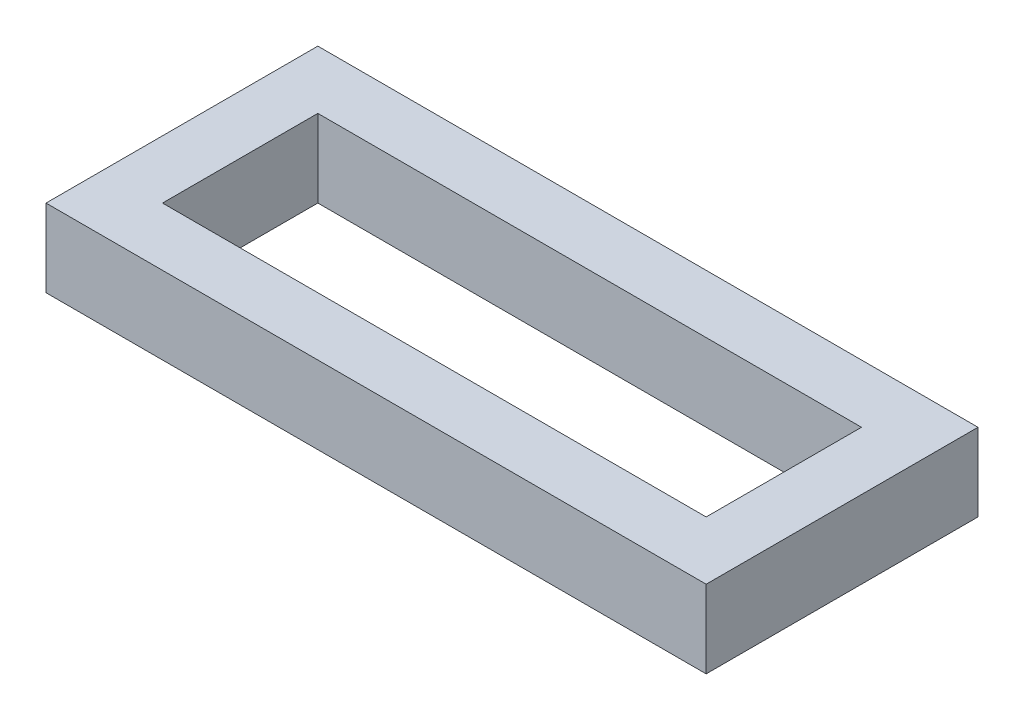
from build123d import *

# Parameters (mm, degrees)
SKETCH1_W           = 170
SKETCH1_H           = 70
SKETCH1_W_2         = 140
SKETCH1_H_2         = 40
BOSS_EXTRUDE1_DEPTH = 20


with BuildPart() as part:
    # Sketch1 → Boss-Extrude1 (new body)
    with BuildSketch(Plane(origin=(0, 0, 0), x_dir=(1, 0, 0), z_dir=(0, 1, 0))):
        Rectangle(SKETCH1_W, SKETCH1_H)
        Rectangle(SKETCH1_W_2, SKETCH1_H_2, mode=Mode.SUBTRACT)
    extrude(amount=BOSS_EXTRUDE1_DEPTH)


solid = part.part
